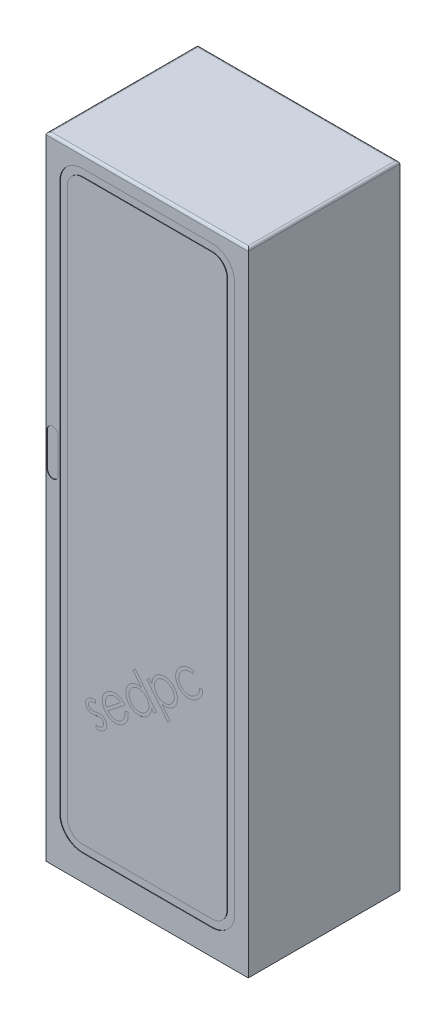
from build123d import *

# Parameters (mm, degrees)
CROQUIS1_W              = 800
CROQUIS1_H              = 600
SALIENTE_EXTRUIR1_DEPTH = 2500
CORTAR_EXTRUIR1_DEPTH   = 2
CORTAR_EXTRUIR2_DEPTH   = 2
CORTAR_EXTRUIR3_DEPTH   = 0.001
REDONDEO1_R             = 10
CROQUIS5_W              = 770.40872847
CROQUIS5_H              = 568.559773596
CROQUIS5_W_2            = 750.40872847
CROQUIS5_H_2            = 548.559773596
CORTAR_EXTRUIR4_DEPTH   = 10


with BuildPart() as part:
    # Croquis1 → Saliente-Extruir1 (new body)
    with BuildSketch(Plane(origin=(0, 0, 0), x_dir=(1, 0, 0), z_dir=(0, 1, 0))):
        Rectangle(CROQUIS1_W, CROQUIS1_H)
    extrude(amount=SALIENTE_EXTRUIR1_DEPTH)

    # Croquis2 → Cortar-Extruir1 (cut)
    with BuildSketch(Plane.XY.offset(300)):
        with BuildLine():
            Line((-345.995350553, 2356.549502458), (-345.995350553, 190.849800125))
            ThreePointArc((-345.995350553, 190.849800125), (-319.63496086, 127.210189818), (-255.995350553, 100.849800125))
            Line((-255.995350553, 100.849800125), (255.995350553, 100.849800125))
            ThreePointArc((255.995350553, 100.849800125), (319.63496086, 127.210189818), (345.995350553, 190.849800125))
            Line((345.995350553, 190.849800125), (345.995350553, 2356.549502458))
            ThreePointArc((345.995350553, 2356.549502458), (319.63496086, 2420.189112765), (255.995350553, 2446.549502458))
            Line((255.995350553, 2446.549502458), (-255.995350553, 2446.549502458))
            ThreePointArc((-255.995350553, 2446.549502458), (-319.63496086, 2420.189112765), (-345.995350553, 2356.549502458))
        make_face()
        with BuildLine():
            Line((-255.995350553, 2416.549502458), (255.995350553, 2416.549502458))
            ThreePointArc((255.995350553, 2416.549502458), (298.421757424, 2398.975909329), (315.995350553, 2356.549502458))
            Line((315.995350553, 2356.549502458), (315.995350553, 190.849800125))
            ThreePointArc((315.995350553, 190.849800125), (298.421757424, 148.423393254), (255.995350553, 130.849800125))
            Line((255.995350553, 130.849800125), (-255.995350553, 130.849800125))
            ThreePointArc((-255.995350553, 130.849800125), (-298.421757424, 148.423393254), (-315.995350553, 190.849800125))
            Line((-315.995350553, 190.849800125), (-315.995350553, 2356.549502458))
            ThreePointArc((-315.995350553, 2356.549502458), (-298.421757424, 2398.975909329), (-255.995350553, 2416.549502458))
        make_face(mode=Mode.SUBTRACT)
    extrude(amount=-CORTAR_EXTRUIR1_DEPTH, mode=Mode.SUBTRACT)

    # Croquis3 → Cortar-Extruir2 (cut)
    with BuildSketch(Plane.XY.offset(300)):
        with BuildLine():
            Line((-352.039613588, 1482.116331648), (-352.039613588, 1345.934548055))
            ThreePointArc((-352.039613588, 1345.934548055), (-374.032766404, 1323.94139524), (-396.025919219, 1345.934548055))
            Line((-396.025919219, 1345.934548055), (-396.025919219, 1482.116331648))
            ThreePointArc((-396.025919219, 1482.116331648), (-374.032766404, 1504.109484464), (-352.039613588, 1482.116331648))
        make_face()
    extrude(amount=-CORTAR_EXTRUIR2_DEPTH, mode=Mode.SUBTRACT)

    # Croquis4 → Cortar-Extruir3 (cut)
    # profile 1 of 5: a face of its own
    with BuildSketch(Plane.XY.offset(300)):
        with BuildLine():
            Line((-203.915979292, 649.427035801), (-205.082011611, 637.89921629))
            add(Edge.make_bspline(
                [(-205.082011611, 637.89921629), (-206.20292916, 637.991669027), (-208.380368568, 638.171263176), (-211.571447446, 638.219370126), (-214.561719159, 637.956332048), (-217.366618979, 637.571329886), (-219.951852694, 636.859366041), (-222.350778345, 635.972084189), (-224.557792485, 634.831135593), (-225.869824997, 633.870795422), (-226.521105828, 633.394091424)],
                knots=[0, 0, 0, 0, 1.201998688, 2.334943647, 3.405141437, 4.407876695, 5.355968598, 6.264257816, 7.138393598, 8, 8, 8, 8], degree=3))
            add(Edge.make_bspline(
                [(-226.521105828, 633.394091424), (-227.265759084, 632.750500729), (-228.730548431, 631.484509092), (-230.403850776, 629.125543151), (-231.627645798, 626.534259904), (-232.324225887, 623.753814946), (-232.527781884, 620.955661414), (-232.166508211, 618.287280084), (-231.350882587, 615.779648435), (-230.341267799, 614.363163051), (-229.833697642, 613.651044215)],
                knots=[0, 0, 0, 0, 1.063059086, 2.09111773, 3.105858466, 4.152767562, 5.179042619, 6.125206948, 7.057473192, 8, 8, 8, 8], degree=3))
            add(Edge.make_bspline(
                [(-229.833697642, 613.651044215), (-229.307651585, 613.061781226), (-228.247668339, 611.87441581), (-226.231673052, 610.509507339), (-223.943571836, 609.404327737), (-222.256664385, 609.007595256), (-221.379963334, 608.8014098)],
                knots=[0, 0, 0, 0, 0.950109259, 1.914470952, 2.916131702, 4, 4, 4, 4], degree=3))
            add(Edge.make_bspline(
                [(-221.379963334, 608.8014098), (-220.886773144, 608.702199364), (-219.82837972, 608.489292306), (-218.095290901, 608.388644045), (-216.14063636, 608.352827996), (-213.96527171, 608.476334013), (-211.579336969, 608.689977116), (-208.970442406, 609.007163468), (-206.1365234, 609.467613841), (-204.171445617, 609.831056357), (-203.147457992, 610.020443587)],
                knots=[0, 0, 0, 0, 0.65622073, 1.408259367, 2.26198252, 3.20903847, 4.251349148, 5.390295976, 6.640102368, 8, 8, 8, 8], degree=3))
            add(Edge.make_bspline(
                [(-203.147457992, 610.020443587), (-201.903414864, 610.250202831), (-199.492203224, 610.695523537), (-195.973479017, 611.195206378), (-192.676727163, 611.549655328), (-189.608585075, 611.73449741), (-186.76714396, 611.78362131), (-184.158637965, 611.606277717), (-181.769378147, 611.348817347), (-180.274957402, 611.005703739), (-179.561804279, 610.841966357)],
                knots=[0, 0, 0, 0, 1.277049323, 2.475184441, 3.587076318, 4.623445497, 5.577712569, 6.453312485, 7.261904631, 8, 8, 8, 8], degree=3))
            add(Edge.make_bspline(
                [(-179.561804279, 610.841966357), (-178.254807612, 610.405935119), (-175.6699135, 609.543580524), (-172.109850417, 607.535965103), (-168.888576751, 604.99777017), (-167.109145934, 602.915653144), (-166.205434087, 601.858217358)],
                knots=[0, 0, 0, 0, 1.008735229, 1.995011786, 2.981735291, 4, 4, 4, 4], degree=3))
            add(Edge.make_bspline(
                [(-166.205434087, 601.858217358), (-165.61599296, 601.073694184), (-164.452888865, 599.525647951), (-162.993248375, 597.049589098), (-161.814295254, 594.49413692), (-160.944935217, 591.858848333), (-160.328519975, 589.161903385), (-159.978481321, 586.392433652), (-159.930509762, 583.54140063), (-160.172765789, 580.649180182), (-160.676198208, 577.786804383), (-161.399926539, 575.004395734), (-162.463252483, 572.374589055), (-163.720194951, 569.833109886), (-165.309598572, 567.441121404), (-167.14142096, 565.167259882), (-169.21338243, 562.986384766), (-170.784057627, 561.702070917), (-171.585083192, 561.047086215)],
                knots=[0, 0, 0, 0, 1.024771033, 2.022110996, 2.99689806, 3.960166467, 4.916332337, 5.883793205, 6.871647761, 7.890414713, 8.911729369, 9.905903301, 10.888092044, 11.870584366, 12.86394377, 13.881706599, 14.9196957, 16, 16, 16, 16], degree=3))
            add(Edge.make_bspline(
                [(-171.585083192, 561.047086215), (-172.705784427, 560.21424148), (-174.9352517, 558.557421604), (-178.606781626, 556.592743777), (-182.443629736, 554.961247054), (-186.475388808, 553.855020069), (-190.577529221, 553.150258358), (-194.685184893, 552.943277166), (-198.765564031, 553.182033734), (-201.421105077, 553.743454622), (-202.749946974, 554.024391571)],
                knots=[0, 0, 0, 0, 1.012573283, 2.014362905, 3.014960873, 4.034337092, 5.042410796, 6.031512485, 7.014962059, 8, 8, 8, 8], degree=3))
            Line((-202.749946974, 554.024391571), (-202.087428611, 565.949722099))
            add(Edge.make_bspline(
                [(-202.087428611, 565.949722099), (-200.932643946, 565.76236373), (-198.693850455, 565.399130038), (-195.385566759, 565.19017253), (-192.261957532, 565.256453207), (-189.3130533, 565.628039954), (-186.543199001, 566.281424735), (-183.963638967, 567.251140224), (-181.531151364, 568.452447381), (-180.095015876, 569.522050854), (-179.376299137, 570.057335948)],
                knots=[0, 0, 0, 0, 1.178838224, 2.285426386, 3.336624783, 4.324141143, 5.276705581, 6.198121493, 7.098246472, 8, 8, 8, 8], degree=3))
            add(Edge.make_bspline(
                [(-179.376299137, 570.057335948), (-178.460639446, 570.856228552), (-176.67230569, 572.416509762), (-174.574138565, 575.256565612), (-173.082893992, 578.398654986), (-172.239611744, 581.757362342), (-171.947318477, 585.150604051), (-172.332703096, 588.405131616), (-173.412367111, 591.43079485), (-174.608919653, 593.162409783), (-175.21568382, 594.040500678)],
                knots=[0, 0, 0, 0, 1.079191981, 2.107721313, 3.117197662, 4.156610572, 5.174018382, 6.132759675, 7.053134333, 8, 8, 8, 8], degree=3))
            add(Edge.make_bspline(
                [(-175.21568382, 594.040500678), (-175.794984399, 594.698647577), (-176.938171486, 595.997429353), (-179.022882841, 597.554229703), (-181.361155778, 598.719055183), (-183.049765022, 599.166337781), (-183.907924738, 599.393649049)],
                knots=[0, 0, 0, 0, 1.008592531, 1.990348358, 2.978684921, 4, 4, 4, 4], degree=3))
            add(Edge.make_bspline(
                [(-183.907924738, 599.393649049), (-184.392807817, 599.472369874), (-185.437132328, 599.64191608), (-187.157648489, 599.735430859), (-189.131331789, 599.70254071), (-191.35848041, 599.531271606), (-193.840789902, 599.258698209), (-196.582905699, 598.896140611), (-199.583746558, 598.378958808), (-201.664041284, 597.983521151), (-202.749946974, 597.777104244)],
                knots=[0, 0, 0, 0, 0.620024915, 1.335388354, 2.172146697, 3.111620233, 4.155088859, 5.325755624, 6.604054922, 8, 8, 8, 8], degree=3))
            add(Edge.make_bspline(
                [(-202.749946974, 597.777104244), (-203.931749835, 597.553391995), (-206.208702596, 597.122370679), (-209.546002645, 596.685752982), (-212.655469137, 596.353352591), (-215.564963032, 596.193573303), (-218.265733724, 596.17255259), (-220.759448263, 596.37490833), (-223.052228668, 596.661898976), (-224.483176058, 597.021564747), (-225.169568368, 597.194088085)],
                knots=[0, 0, 0, 0, 1.276439589, 2.459287198, 3.57141654, 4.594998421, 5.551397812, 6.435225974, 7.249414153, 8, 8, 8, 8], degree=3))
            add(Edge.make_bspline(
                [(-225.169568368, 597.194088085), (-226.443551202, 597.61773767), (-228.979033643, 598.460885676), (-232.426975317, 600.515935828), (-235.617550618, 603.024398501), (-237.383953028, 605.093191029), (-238.28743195, 606.151336349)],
                knots=[0, 0, 0, 0, 0.995732922, 1.981709072, 2.967685222, 4, 4, 4, 4], degree=3))
            add(Edge.make_bspline(
                [(-238.28743195, 606.151336349), (-238.831565451, 606.883759443), (-239.895519167, 608.315879082), (-241.231382846, 610.599846267), (-242.318685185, 612.922537914), (-243.15641655, 615.308342928), (-243.71335214, 617.753556378), (-243.996131531, 620.250547882), (-244.056220999, 622.797696754), (-243.842388258, 625.373043362), (-243.369532828, 627.929925474), (-242.643485318, 630.400306389), (-241.725584637, 632.784330297), (-240.516290908, 635.040493024), (-239.081198441, 637.199796894), (-237.388838993, 639.243916463), (-235.49579553, 641.219521469), (-234.060334824, 642.392191432), (-233.331794597, 642.987357316)],
                knots=[0, 0, 0, 0, 1.052457725, 2.057888929, 3.047690716, 4.008556965, 4.970666495, 5.935581014, 6.904365958, 7.906846324, 8.912690987, 9.900021749, 10.875063367, 11.855632957, 12.848161477, 13.862496168, 14.915151408, 16, 16, 16, 16], degree=3))
            add(Edge.make_bspline(
                [(-233.331794597, 642.987357316), (-232.420582535, 643.657956101), (-230.591441291, 645.004097079), (-227.512634227, 646.576490773), (-224.220990977, 647.899016709), (-220.636907881, 648.826510235), (-216.819263334, 649.502989688), (-212.737655285, 649.797275553), (-208.405578681, 649.805005474), (-205.443086097, 649.555599624), (-203.915979292, 649.427035801)],
                knots=[0, 0, 0, 0, 0.878293184, 1.763060822, 2.678768281, 3.631708029, 4.635487492, 5.689511812, 6.80898867, 8, 8, 8, 8], degree=3))
        make_face()
    # profile 2 of 5: a face of its own
    with BuildSketch(Plane.XY.offset(300)):
        with BuildLine():
            Line((-88.239101445, 671.363841311), (-76.499276057, 673.536901541))
            add(Edge.make_bspline(
                [(-76.499276057, 673.536901541), (-76.167435992, 671.712875472), (-75.522936361, 668.170252824), (-75.101961001, 662.91800793), (-75.143567919, 657.932602717), (-75.645881809, 653.192584487), (-76.593708432, 648.673623134), (-77.898928674, 644.312886789), (-79.688565553, 640.137636449), (-81.786449724, 636.077977315), (-84.401159339, 632.217746194), (-87.430670754, 628.482510798), (-90.968150834, 624.927739483), (-93.599506512, 622.757284025), (-94.943787275, 621.648463373)],
                knots=[0, 0, 0, 0, 1.143933784, 2.221747703, 3.24700365, 4.217761683, 5.158905441, 6.093867512, 7.022590742, 7.959268749, 8.910594805, 9.895131774, 10.924685899, 12, 12, 12, 12], degree=3))
            add(Edge.make_bspline(
                [(-94.943787275, 621.648463373), (-96.494193843, 620.47673991), (-99.511796773, 618.196179294), (-104.306083354, 615.386606416), (-109.106127685, 613.094478168), (-113.992291889, 611.443582326), (-118.925670784, 610.369119952), (-123.915801739, 609.890754225), (-128.950223508, 609.995670917), (-133.962753014, 610.704412671), (-138.859232037, 611.871699805), (-143.556515161, 613.407558135), (-148.015075093, 615.291084639), (-152.210834193, 617.558842888), (-156.182048016, 620.153850158), (-159.877832575, 623.141330407), (-163.318367794, 626.489834832), (-165.377396461, 628.961257613), (-166.416268245, 630.208200619)],
                knots=[0, 0, 0, 0, 1.157730951, 2.253326568, 3.306441312, 4.324020364, 5.320835932, 6.310222478, 7.305813012, 8.31577251, 9.322376012, 10.303316455, 11.259007635, 12.203885021, 13.14310952, 14.083219523, 15.032898771, 16, 16, 16, 16], degree=3))
            add(Edge.make_bspline(
                [(-166.416268245, 630.208200619), (-167.339212503, 631.429750562), (-169.161355908, 633.84142294), (-171.490983169, 637.693056474), (-173.49950639, 641.644426704), (-175.105683397, 645.741765934), (-176.40018962, 649.945471669), (-177.281738509, 654.27773508), (-177.869625562, 658.724577291), (-177.936682909, 661.73332932), (-177.970588491, 663.254616552)],
                knots=[0, 0, 0, 0, 1.029117673, 2.031758652, 3.022820707, 4.006930989, 4.988005745, 5.977267536, 6.977264647, 8, 8, 8, 8], degree=3))
            add(Edge.make_bspline(
                [(-177.970588491, 663.254616552), (-177.928201202, 665.166307014), (-177.844917393, 668.92245343), (-176.934583359, 674.416041984), (-175.483834299, 679.660688378), (-173.403081344, 684.633111689), (-170.732800236, 689.346944203), (-167.425653837, 693.755270233), (-163.58973078, 697.964570549), (-160.61807208, 700.425318636), (-159.102065521, 701.680681589)],
                knots=[0, 0, 0, 0, 1.031906954, 2.027521548, 2.999008513, 3.965936907, 4.931958079, 5.917918558, 6.937815731, 8, 8, 8, 8], degree=3))
            add(Edge.make_bspline(
                [(-159.102065521, 701.680681589), (-157.477014803, 702.904599589), (-154.295881354, 705.30049188), (-149.153995487, 708.1495703), (-143.943289196, 710.413049098), (-138.595503961, 711.991510195), (-133.121329532, 712.903350287), (-127.528033699, 713.117487075), (-121.809799906, 712.758198542), (-118.036217685, 711.949875207), (-116.117874148, 711.538954826)],
                knots=[0, 0, 0, 0, 1.066023905, 2.086805209, 3.074922589, 4.041165393, 5.004069099, 5.978058612, 6.972123047, 8, 8, 8, 8], degree=3))
            add(Edge.make_bspline(
                [(-116.117874148, 711.538954826), (-114.749367374, 711.176159642), (-112.006710475, 710.449073204), (-108.039282485, 708.890447151), (-104.190311629, 706.996431409), (-100.472221999, 704.738143451), (-96.882859995, 702.092554951), (-93.417162892, 699.100106553), (-90.078599585, 695.739895352), (-88.018559955, 693.286623285), (-86.967066188, 692.034414228)],
                knots=[0, 0, 0, 0, 0.950334172, 1.904587264, 2.857234071, 3.82905354, 4.822389801, 5.848913756, 6.902033853, 8, 8, 8, 8], degree=3))
            Line((-86.967066188, 692.034414228), (-155.815974441, 637.654907016))
            add(Edge.make_bspline(
                [(-155.815974441, 637.654907016), (-154.90622767, 636.595986121), (-153.12876375, 634.527065688), (-150.202302161, 631.750952221), (-147.169749995, 629.309442775), (-143.991718208, 627.22460115), (-140.690962371, 625.491419177), (-137.255238002, 624.105793038), (-133.685949884, 623.070507112), (-130.020539641, 622.380928593), (-126.336113396, 622.074409087), (-122.705757235, 622.085940822), (-119.16020573, 622.485195017), (-115.707978401, 623.260686649), (-112.338697486, 624.379079517), (-109.070303675, 625.871630371), (-105.896551403, 627.737178023), (-103.905670194, 629.217480879), (-102.894007628, 629.969694009)],
                knots=[0, 0, 0, 0, 1.122997366, 2.194113091, 3.241173963, 4.252779172, 5.248164605, 6.237028529, 7.229260459, 8.234650525, 9.233660299, 10.20060762, 11.152194513, 12.099175401, 13.043456848, 14.00432103, 14.985899461, 16, 16, 16, 16], degree=3))
            add(Edge.make_bspline(
                [(-102.894007628, 629.969694009), (-101.951641152, 630.757221047), (-100.06439772, 632.334373107), (-97.504129595, 634.991943446), (-95.177141578, 637.872150456), (-93.140863323, 640.958662779), (-91.343781745, 644.130275017), (-89.868817386, 647.35430746), (-88.756876884, 650.586476529), (-87.950321244, 653.910192729), (-87.492265862, 657.534242747), (-87.42945057, 661.640270079), (-87.637350108, 666.323912356), (-88.030510836, 669.616804318), (-88.239101445, 671.363841311)],
                knots=[0, 0, 0, 0, 0.954867178, 1.912278138, 2.865338331, 3.83168532, 4.785538037, 5.698948386, 6.585650713, 7.440737796, 8.355362392, 9.42091054, 10.631669442, 12, 12, 12, 12], degree=3))
        make_face()
        with BuildLine():
            add(Edge.make_bspline(
                [(-104.537053167, 691.981412759), (-105.870370601, 692.971009041), (-108.434430601, 694.874069916), (-112.431354596, 697.195227062), (-116.341734536, 698.937632626), (-120.19106702, 700.142543737), (-124.061416849, 700.786036424), (-128.011272109, 700.92863712), (-132.095237396, 700.645538554), (-136.235436928, 699.828602274), (-140.350912272, 698.641952247), (-144.288301222, 696.965186847), (-148.069776571, 694.957203064), (-150.350876315, 693.240822473), (-151.496354717, 692.378923776)],
                knots=[0, 0, 0, 0, 1.171203055, 2.252303036, 3.254382575, 4.187174798, 5.091187161, 6.014661174, 6.971012206, 7.973673414, 8.987667972, 9.988078187, 10.989692148, 12, 12, 12, 12], degree=3))
            add(Edge.make_bspline(
                [(-151.496354717, 692.378923776), (-152.401177151, 691.624597102), (-154.184338696, 690.138022203), (-156.608147469, 687.690555518), (-158.731862125, 685.086616499), (-160.586457856, 682.331693531), (-162.132342119, 679.417852284), (-163.454038731, 676.37835226), (-164.467383232, 673.179011588), (-164.91673597, 670.971109698), (-165.144232989, 669.853299444)],
                knots=[0, 0, 0, 0, 1.048561153, 2.066431884, 3.061526374, 4.03671131, 5.018567119, 5.994608218, 6.984715984, 8, 8, 8, 8], degree=3))
            add(Edge.make_bspline(
                [(-165.144232989, 669.853299444), (-165.26548365, 669.006763226), (-165.510909718, 667.293271091), (-165.599163219, 664.658784282), (-165.50089376, 661.937737526), (-165.140228089, 659.123079836), (-164.579241659, 656.203449338), (-163.814058443, 653.181699387), (-162.800827087, 650.079253655), (-161.983983505, 648.012586522), (-161.56663383, 646.956664829)],
                knots=[0, 0, 0, 0, 0.87371212, 1.76849946, 2.690358026, 3.65480439, 4.666142842, 5.728453175, 6.839399181, 8, 8, 8, 8], degree=3))
            Line((-161.56663383, 646.956664829), (-104.537053167, 691.981412759))
        make_face(mode=Mode.SUBTRACT)
    # profile 3 of 5: a face of its own
    with BuildSketch(Plane.XY.offset(300)):
        with BuildLine():
            Line((-46.966671374, 835.208211672), (36.881652611, 729.046269231))
            Line((36.881652611, 729.046269231), (27.182383781, 721.387556958))
            Line((27.182383781, 721.387556958), (16.794095854, 734.558422009))
            add(Edge.make_bspline(
                [(16.794095854, 734.558422009), (16.706405252, 732.539986759), (16.53423286, 728.576975706), (15.517821224, 722.817429539), (14.024212787, 717.350084846), (11.913671496, 712.226844065), (9.280055822, 707.399547503), (6.043412619, 702.945148864), (2.292522052, 698.780283919), (-0.586346817, 696.356079157), (-2.047926382, 695.12532906)],
                knots=[0, 0, 0, 0, 1.070806407, 2.102429407, 3.095070179, 4.072381608, 5.035100833, 6.005364318, 6.987338818, 8, 8, 8, 8], degree=3))
            add(Edge.make_bspline(
                [(-2.047926382, 695.12532906), (-3.404917318, 694.104492333), (-6.081837482, 692.09069965), (-10.419974746, 689.647018794), (-14.847684238, 687.602007888), (-19.434725758, 686.081288291), (-24.165221561, 685.084576057), (-29.027080593, 684.511335138), (-34.043327332, 684.479013493), (-39.135089695, 684.89723136), (-44.186101547, 685.785074378), (-49.054550656, 687.145299784), (-53.696798277, 688.918085678), (-58.095759951, 691.166608832), (-62.275244561, 693.848150924), (-66.198963557, 697.000800249), (-69.923030646, 700.555639647), (-72.133008819, 703.228575679), (-73.255400006, 704.586091279)],
                knots=[0, 0, 0, 0, 1.018695863, 2.009569426, 2.982850762, 3.944029974, 4.904330541, 5.881435047, 6.878748114, 7.911326073, 8.945646597, 9.953372744, 10.942427198, 11.924572689, 12.914835518, 13.918897143, 14.943061278, 16, 16, 16, 16], degree=3))
            add(Edge.make_bspline(
                [(-73.255400006, 704.586091279), (-74.28908176, 705.972408466), (-76.322230413, 708.699155753), (-78.879821692, 713.058585208), (-80.957986289, 717.549791337), (-82.554117285, 722.184749519), (-83.687406794, 726.95891578), (-84.270478992, 731.873721805), (-84.449245237, 736.921615201), (-84.081730321, 742.038178416), (-83.317205345, 747.108496512), (-82.055337146, 751.984722877), (-80.398785856, 756.622118838), (-78.251469161, 760.988356813), (-75.710150537, 765.126091647), (-72.678184372, 768.972476339), (-69.26555712, 772.619508406), (-66.672919203, 774.760738953), (-65.358181122, 775.846566373)],
                knots=[0, 0, 0, 0, 1.040647943, 2.046850449, 3.036895977, 4.015892042, 4.99386164, 5.985463384, 6.991272162, 8.030791219, 9.069697718, 10.074676347, 11.05898991, 12.029568965, 12.999346064, 13.977156535, 14.97420719, 16, 16, 16, 16], degree=3))
            add(Edge.make_bspline(
                [(-65.358181122, 775.846566373), (-63.786694926, 777.019113295), (-60.699007108, 779.322957171), (-55.662483555, 782.013850031), (-50.489417402, 784.09971598), (-45.120652917, 785.440794514), (-39.594398535, 786.156616718), (-33.900879708, 786.086162627), (-28.039349218, 785.434651471), (-24.166228174, 784.420598574), (-22.188484608, 783.902789664)],
                knots=[0, 0, 0, 0, 1.027526243, 2.018904316, 2.986340022, 3.947504209, 4.914495678, 5.901769548, 6.92857421, 8, 8, 8, 8], degree=3))
            Line((-22.188484608, 783.902789664), (-56.665940204, 827.549499399))
            Line((-56.665940204, 827.549499399), (-46.966671374, 835.208211672))
        make_face()
        with BuildLine():
            add(Edge.make_bspline(
                [(-57.063451221, 766.995321047), (-58.377451075, 765.881450859), (-60.978778822, 763.676320152), (-64.274298503, 759.786407599), (-66.997060572, 755.525486758), (-69.17460301, 750.955494322), (-70.713736619, 746.114473893), (-71.601056754, 741.10542033), (-71.770649795, 735.962191553), (-71.298091693, 730.770475801), (-70.164481012, 725.670454145), (-68.431300566, 720.796939464), (-66.099715104, 716.2125486), (-64.089191717, 713.448126127), (-63.079117955, 712.059298411)],
                knots=[0, 0, 0, 0, 1.008956545, 1.99743299, 2.976139592, 3.968031691, 4.957688682, 5.946599515, 6.942003417, 7.966902816, 8.996401365, 9.997666644, 10.994040856, 12, 12, 12, 12], degree=3))
            add(Edge.make_bspline(
                [(-63.079117955, 712.059298411), (-61.975558969, 710.75220434), (-59.778600099, 708.150048997), (-55.828006712, 704.860759015), (-51.48573752, 702.026946542), (-46.738374059, 699.736511613), (-41.749262063, 698.0657679), (-36.662600574, 696.986314945), (-31.541929711, 696.691285657), (-26.443023324, 697.018368459), (-21.473287369, 698.061535676), (-16.724135767, 699.71081162), (-12.232210387, 701.966847126), (-9.531357615, 703.937170111), (-8.169596053, 704.930600828)],
                knots=[0, 0, 0, 0, 1.001308669, 1.993399527, 3.000424816, 4.035870679, 5.074252734, 6.078824397, 7.075178156, 8.071868391, 9.066295316, 10.042523037, 11.013046207, 12, 12, 12, 12], degree=3))
            add(Edge.make_bspline(
                [(-8.169596053, 704.930600828), (-6.873141272, 706.026860522), (-4.287856943, 708.212932147), (-1.007973823, 712.104725565), (1.780060775, 716.398489715), (4.040739582, 721.051700044), (5.70154253, 725.946922548), (6.719578511, 730.943505924), (6.940267839, 735.979730921), (6.494304106, 740.999855998), (5.341066578, 745.955039328), (3.525721734, 750.760548571), (1.070347315, 755.426883127), (-1.045056871, 758.276221778), (-2.127428585, 759.734119792)],
                knots=[0, 0, 0, 0, 0.992340039, 1.978843528, 2.965550254, 3.9830579, 4.998461354, 5.984110792, 6.957299134, 7.938490073, 8.925589604, 9.925337872, 10.938474444, 12, 12, 12, 12], degree=3))
            add(Edge.make_bspline(
                [(-2.127428585, 759.734119792), (-3.006474955, 760.805513337), (-4.734365609, 762.91148972), (-7.663823918, 765.677249488), (-10.676624082, 768.180352183), (-13.904691858, 770.285976673), (-17.308965194, 772.001293182), (-20.863267349, 773.39995281), (-24.585974068, 774.426900053), (-28.42762373, 775.112898565), (-32.30511104, 775.426495126), (-36.141888391, 775.390418527), (-39.875696145, 774.922727242), (-43.536610418, 774.141070705), (-47.069236619, 772.903480574), (-50.528099904, 771.330156711), (-53.881992682, 769.361280729), (-55.990873252, 767.792966592), (-57.063451221, 766.995321047)],
                knots=[0, 0, 0, 0, 1.074713624, 2.112502469, 3.121321265, 4.11219979, 5.0965799, 6.075787847, 7.072320672, 8.089193713, 9.100526181, 10.088029915, 11.061869265, 12.016840869, 12.988311541, 13.960991444, 14.96295898, 16, 16, 16, 16], degree=3))
        make_face(mode=Mode.SUBTRACT)
    # profile 4 of 5: a face of its own
    with BuildSketch(Plane.XY.offset(300)):
        with BuildLine():
            Line((-1.460321888, 823.268871584), (8.318449146, 830.980585326))
            Line((8.318449146, 830.980585326), (19.422256905, 816.908695302))
            add(Edge.make_bspline(
                [(19.422256905, 816.908695302), (19.39156154, 818.960097121), (19.331557024, 822.970258788), (20.057641473, 828.825393495), (21.306824653, 834.367109564), (23.230374833, 839.57981966), (25.794252036, 844.450625692), (28.955196722, 849.003057555), (32.73684465, 853.228749021), (35.662010556, 855.695468229), (37.151248291, 856.951305144)],
                knots=[0, 0, 0, 0, 1.078956185, 2.109186361, 3.097382135, 4.064071175, 5.025105834, 5.987478551, 6.975400719, 8, 8, 8, 8], degree=3))
            add(Edge.make_bspline(
                [(37.151248291, 856.951305144), (38.51810333, 857.978938674), (41.208421859, 860.001582955), (45.546974574, 862.495955101), (50.010896738, 864.520184633), (54.615735572, 866.074368336), (59.371715281, 867.106825028), (64.263580695, 867.661124185), (69.2956246, 867.73613903), (74.402366311, 867.328681217), (79.463383225, 866.506712092), (84.346947764, 865.203289215), (88.977780073, 863.444855879), (93.370614129, 861.260513393), (97.532862772, 858.662015288), (101.406915984, 855.579318215), (105.079187968, 852.105036981), (107.254024805, 849.484267551), (108.358721916, 848.153061287)],
                knots=[0, 0, 0, 0, 1.028462288, 2.024275488, 3.004639916, 3.974757892, 4.943592911, 5.928229915, 6.93322652, 7.967758991, 9.007905076, 10.01514937, 11.004583467, 11.984212346, 12.963711365, 13.951844675, 14.959650107, 16, 16, 16, 16], degree=3))
            add(Edge.make_bspline(
                [(108.358721916, 848.153061287), (109.420789075, 846.741559467), (111.507384308, 843.968445784), (114.107975736, 839.526808591), (116.244495294, 834.978719835), (117.904633174, 830.295189332), (119.038884355, 825.477059398), (119.704090469, 820.542628515), (119.894454442, 815.491574697), (119.557967662, 810.383898914), (118.813726499, 805.33235108), (117.587471633, 800.471476632), (115.953054904, 795.852531458), (113.82606722, 791.507316852), (111.315998637, 787.377480846), (108.321813451, 783.520091225), (104.890067563, 779.916921885), (102.320845926, 777.769511418), (101.018018457, 776.680580318)],
                knots=[0, 0, 0, 0, 1.059828726, 2.082197485, 3.083452393, 4.073108026, 5.059774831, 6.049856702, 7.058221931, 8.089084319, 9.118922976, 10.119672086, 11.094335216, 12.055002128, 13.019176202, 13.99089123, 14.981200354, 16, 16, 16, 16], degree=3))
            add(Edge.make_bspline(
                [(101.018018457, 776.680580318), (99.488768715, 775.537938622), (96.478802801, 773.288919077), (91.567729582, 770.611620392), (86.489315112, 768.517965483), (81.206698157, 767.0907388), (75.747873395, 766.25958032), (70.113971102, 766.064849905), (64.283845459, 766.450278363), (60.395361185, 767.187131086), (58.404837367, 767.564327647)],
                knots=[0, 0, 0, 0, 1.014308453, 1.996425952, 2.965816421, 3.930126283, 4.899653389, 5.896474631, 6.923200648, 8, 8, 8, 8], degree=3))
            Line((58.404837367, 767.564327647), (90.921238609, 726.382186221))
            Line((90.921238609, 726.382186221), (81.142467576, 718.670472479))
            Line((81.142467576, 718.670472479), (-1.460321888, 823.268871584))
        make_face()
        with BuildLine():
            add(Edge.make_bspline(
                [(43.882434857, 846.854525297), (42.858633828, 845.998460624), (40.846937789, 844.316354568), (38.156976123, 841.510198395), (35.80815078, 838.531268319), (33.808916817, 835.360453182), (32.157462922, 832.002694974), (30.854271721, 828.458364809), (29.904098318, 824.736914427), (29.299313096, 820.886518256), (29.052949935, 816.990214748), (29.219415237, 813.119890568), (29.745703642, 809.329059972), (30.64822079, 805.613273437), (31.962117772, 801.996108753), (33.645551511, 798.460639845), (35.682857783, 794.985184493), (37.322965111, 792.812864979), (38.158276203, 791.706496784)],
                knots=[0, 0, 0, 0, 1.034676309, 2.033065189, 3.009144873, 3.973073011, 4.935392122, 5.906697121, 6.897294639, 7.910136587, 8.926218897, 9.920719726, 10.910202574, 11.890818225, 12.881439445, 13.889936955, 14.925339193, 16, 16, 16, 16], degree=3))
            add(Edge.make_bspline(
                [(38.158276203, 791.706496784), (39.32482265, 790.321612027), (41.613923406, 787.604068504), (45.593061143, 784.155726364), (49.832403348, 781.241210081), (54.402875108, 778.987317954), (59.201822196, 777.398473622), (64.168481314, 776.46966889), (69.262679855, 776.312008121), (74.418062923, 776.78515631), (79.484710166, 777.914464891), (84.323179775, 779.655865674), (88.895878301, 781.950337537), (91.636183474, 783.962843641), (93.014796635, 784.975310219)],
                knots=[0, 0, 0, 0, 1.056160779, 2.072492221, 3.064179972, 4.054040765, 5.037859351, 6.008329464, 6.994431713, 8.00478704, 9.024961353, 10.017199218, 11.002477797, 12, 12, 12, 12], degree=3))
            add(Edge.make_bspline(
                [(93.014796635, 784.975310219), (94.287421611, 786.05205768), (96.821375291, 788.19599501), (99.976719528, 792.053495391), (102.715791132, 796.238494059), (104.798334585, 800.85341071), (106.34935811, 805.722497438), (107.240744757, 810.785923166), (107.375729528, 815.983585588), (106.877711718, 821.2173766), (105.732137035, 826.353479723), (104.057772033, 831.272351972), (101.707811615, 835.851156742), (99.711701078, 838.609844718), (98.712454555, 839.990835059)],
                knots=[0, 0, 0, 0, 0.977355975, 1.946036591, 2.914731106, 3.90847948, 4.909570657, 5.910244849, 6.917396312, 7.954707488, 8.990875907, 10.001763306, 10.999689129, 12, 12, 12, 12], degree=3))
            add(Edge.make_bspline(
                [(98.712454555, 839.990835059), (97.597654641, 841.295614101), (95.378395926, 843.893068788), (91.447553214, 847.208160744), (87.12690919, 850.057328869), (82.4038778, 852.288774044), (77.482704554, 854.015587913), (72.429793468, 854.983412783), (67.350466479, 855.330998395), (62.290560568, 854.904636042), (57.324809036, 853.885266814), (52.55643688, 852.202542506), (48.012241372, 849.891880646), (45.270092264, 847.875107891), (43.882434857, 846.854525297)],
                knots=[0, 0, 0, 0, 1.005100153, 2.000876792, 3.003891729, 4.032759455, 5.05676315, 6.05454598, 7.040883764, 8.033488035, 9.023167459, 10.00631607, 10.991101445, 12, 12, 12, 12], degree=3))
        make_face(mode=Mode.SUBTRACT)
    # profile 5 of 5: a face of its own
    with BuildSketch(Plane.XY.offset(300)):
        with BuildLine():
            Line((183.704898458, 943.806703304), (179.756289017, 932.782397749))
            add(Edge.make_bspline(
                [(179.756289017, 932.782397749), (178.049820953, 933.178101775), (174.699962047, 933.954883177), (169.614451322, 934.380054743), (164.641292091, 934.270723582), (159.762171067, 933.513633968), (154.99017185, 932.153539054), (150.325962203, 930.165764522), (145.762978687, 927.587486637), (142.91614371, 925.465181369), (141.462727652, 924.381664909)],
                knots=[0, 0, 0, 0, 1.030442356, 2.022795841, 2.995942134, 3.95386916, 4.922108708, 5.910527412, 6.933245855, 8, 8, 8, 8], degree=3))
            add(Edge.make_bspline(
                [(141.462727652, 924.381664909), (140.339074993, 923.457871424), (138.128841619, 921.640762574), (135.194506388, 918.586517909), (132.572785022, 915.418563615), (130.364958755, 912.05312869), (128.520883697, 908.540051817), (127.061917607, 904.850312826), (125.933268976, 901.004311222), (125.24294376, 897.020809657), (124.885288868, 893.02120778), (124.943140761, 889.079877878), (125.361613803, 885.253304495), (126.161503638, 881.529786583), (127.35812014, 877.91224648), (128.959729517, 874.410173654), (130.932747493, 871.010548324), (132.502386, 868.883923475), (133.300501423, 867.802596734)],
                knots=[0, 0, 0, 0, 1.094087839, 2.152079146, 3.182270231, 4.185521704, 5.175910446, 6.163706543, 7.167486715, 8.187455644, 9.201839113, 10.186025479, 11.14941715, 12.094951462, 13.047473952, 14.011599636, 14.988956379, 16, 16, 16, 16], degree=3))
            add(Edge.make_bspline(
                [(133.300501423, 867.802596734), (134.438484018, 866.459185563), (136.700510187, 863.788818512), (140.747537216, 860.425594284), (145.169781188, 857.558673961), (149.985510276, 855.29504908), (155.049559102, 853.647692014), (160.25668885, 852.712542137), (165.527856311, 852.49135029), (170.823311484, 853.036941123), (176.058000755, 854.287152762), (181.169504795, 856.20720494), (186.08491702, 858.846994879), (189.11002147, 861.077085365), (190.6480909, 862.210941752)],
                knots=[0, 0, 0, 0, 0.985034266, 1.958002959, 2.935695439, 3.932194404, 4.931002413, 5.91176065, 6.887797383, 7.877893957, 8.885313751, 9.895793994, 10.930147707, 12, 12, 12, 12], degree=3))
            add(Edge.make_bspline(
                [(190.6480909, 862.210941752), (192.002142252, 863.337046205), (194.65555686, 865.543773445), (198.08490729, 869.336561624), (201.034794258, 873.358941302), (203.456409122, 877.661125217), (205.3280146, 882.238917279), (206.644331495, 887.081074541), (207.491447554, 892.180348731), (207.604210342, 895.67798906), (207.661562454, 897.456918649)],
                knots=[0, 0, 0, 0, 1.040478202, 2.038933056, 3.014978619, 3.985752314, 4.951112259, 5.93217881, 6.948288574, 8, 8, 8, 8], degree=3))
            Line((207.661562454, 897.456918649), (219.50739078, 898.46394656))
            add(Edge.make_bspline(
                [(219.50739078, 898.46394656), (219.578508236, 897.421981033), (219.720072626, 895.347874048), (219.609451649, 892.231132871), (219.363169324, 889.140152841), (218.874343452, 886.068862241), (218.190589714, 883.02156817), (217.275639544, 880.001113403), (216.201734018, 876.988054106), (214.862352935, 874.035229981), (213.357468292, 871.10606839), (211.634488378, 868.265259976), (209.748530469, 865.483995277), (207.640288895, 862.801133759), (205.335872785, 860.19534677), (202.876082915, 857.630457338), (200.180635792, 855.195838453), (198.286758022, 853.643468474), (197.326275996, 852.856182471)],
                knots=[0, 0, 0, 0, 0.947352145, 1.885772273, 2.827304348, 3.760606689, 4.705954788, 5.659799428, 6.623634348, 7.607080071, 8.600444894, 9.611132677, 10.620802199, 11.648927521, 12.705668728, 13.777361357, 14.872786565, 16, 16, 16, 16], degree=3))
            add(Edge.make_bspline(
                [(197.326275996, 852.856182471), (195.818105271, 851.714160666), (192.862123029, 849.475822445), (188.156325517, 846.664035902), (183.383999158, 844.337435453), (178.498159881, 842.549887808), (173.526551476, 841.274943431), (168.458564221, 840.491502949), (163.298044603, 840.26483399), (158.109122864, 840.535565182), (152.993381908, 841.257330834), (148.08160497, 842.488214345), (143.412327615, 844.125172944), (138.996001903, 846.240030063), (134.838431805, 848.819194091), (130.908326406, 851.829822857), (127.263024362, 855.319568557), (125.0793289, 857.922984383), (123.972242876, 859.242859487)],
                knots=[0, 0, 0, 0, 1.104384751, 2.164570403, 3.19620429, 4.201815261, 5.19804874, 6.189835443, 7.191984977, 8.209847191, 9.221293044, 10.204992417, 11.163020632, 12.1070073, 13.059306739, 14.016069496, 14.994190458, 16, 16, 16, 16], degree=3))
            add(Edge.make_bspline(
                [(123.972242876, 859.242859487), (123.261430663, 860.178891177), (121.850923011, 862.036315452), (119.977130421, 864.965507458), (118.284875371, 867.961237159), (116.869988455, 871.07797169), (115.615443454, 874.257046765), (114.56701223, 877.528182564), (113.794076933, 880.901972795), (113.170024462, 884.330217288), (112.805007807, 887.79352179), (112.669506225, 891.246287486), (112.774556134, 894.682505753), (113.125289863, 898.080250349), (113.671773144, 901.459483429), (114.511466235, 904.789727573), (115.539700433, 908.113322589), (116.805419873, 911.393984359), (118.324069332, 914.587854579), (120.01743616, 917.702454697), (121.930861075, 920.703709187), (124.059933402, 923.587077071), (126.357906861, 926.38447197), (128.904062845, 929.034503988), (131.611824244, 931.611057391), (133.563588596, 933.201074581), (134.546035945, 934.001431536)],
                knots=[0, 0, 0, 0, 1.003790137, 1.99188146, 2.968288247, 3.940808037, 4.913444956, 5.887281632, 6.87213955, 7.868497161, 8.862794643, 9.844640578, 10.818681943, 11.797186527, 12.761235652, 13.740525751, 14.728761175, 15.732267556, 16.741716081, 17.74819792, 18.75942228, 19.779842327, 20.808960912, 21.849938407, 22.917737014, 24, 24, 24, 24], degree=3))
            add(Edge.make_bspline(
                [(134.546035945, 934.001431536), (135.818277685, 934.972084704), (138.348960155, 936.902861599), (142.43704447, 939.334498272), (146.632796075, 941.518439266), (150.982951172, 943.286132101), (155.328152972, 944.736405877), (159.595955328, 945.816764135), (163.736960775, 946.485385572), (167.783589758, 946.765279341), (171.776383086, 946.618224985), (175.764678747, 946.125745766), (179.76835029, 945.191320829), (182.378726504, 944.273162966), (183.704898458, 943.806703304)],
                knots=[0, 0, 0, 0, 1.09783039, 2.183751748, 3.260607942, 4.342983716, 5.403594415, 6.40385836, 7.362069362, 8.279889085, 9.184081413, 10.101099231, 11.035285056, 12, 12, 12, 12], degree=3))
        make_face()
    extrude(amount=-CORTAR_EXTRUIR3_DEPTH, mode=Mode.SUBTRACT)

    # Redondeo1
    redondeo1_edges = [part.edges().sort_by_distance(p)[0] for p in [
        (-400, 2500, 0),
        (0, 2500, 300),
        (400, 2500, 0),
        (0, 2500, -300),
    ]]
    fillet(redondeo1_edges, radius=REDONDEO1_R)

    # Croquis5 → Cortar-Extruir4 (cut)
    with BuildSketch(Plane.XZ):
        Rectangle(CROQUIS5_W, CROQUIS5_H)
        Rectangle(CROQUIS5_W_2, CROQUIS5_H_2, mode=Mode.SUBTRACT)
    extrude(amount=-CORTAR_EXTRUIR4_DEPTH, mode=Mode.SUBTRACT)


solid = part.part
